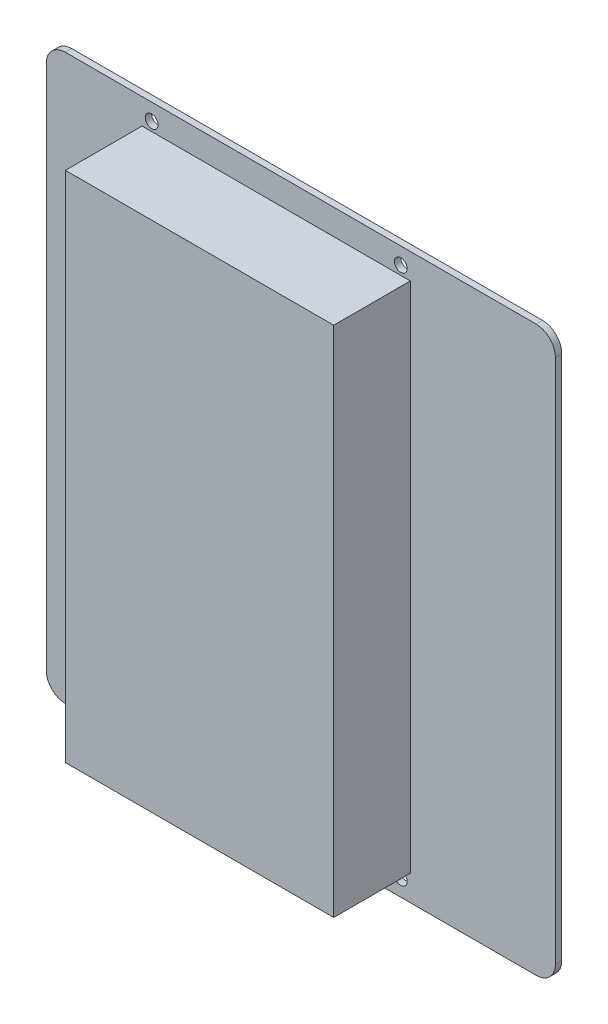
from build123d import *

# Parameters (mm, degrees)
BOSS_EXTRUDE1_DEPTH     = 1.27
SKETCH2_W               = 53.34
SKETCH2_H               = 101.981
BOSS_EXTRUDE2_DEPTH     = 15.24
CUT_EXTRUDE1_DEPTH      = 78.055045652
CUT_EXTRUDE1_DEPTH_BACK = 78.055045652
SKETCH4_R               = 1.27


with BuildPart() as part:
    # Sketch1 → Boss-Extrude1 (new body)
    with BuildSketch(Plane.XY):
        with BuildLine():
            Line((-46.7995, 56.0705), (46.7995, 56.0705))
            ThreePointArc((46.7995, 56.0705), (49.493576836, 54.954576836), (50.6095, 52.2605))
            Line((50.6095, 52.2605), (50.6095, -52.2605))
            ThreePointArc((50.6095, -52.2605), (49.493576836, -54.954576836), (46.7995, -56.0705))
            Line((46.7995, -56.0705), (-46.7995, -56.0705))
            ThreePointArc((-46.7995, -56.0705), (-49.493576836, -54.954576836), (-50.6095, -52.2605))
            Line((-50.6095, -52.2605), (-50.6095, 52.2605))
            ThreePointArc((-50.6095, 52.2605), (-49.493576836, 54.954576836), (-46.7995, 56.0705))
        make_face()
    extrude(amount=BOSS_EXTRUDE1_DEPTH)

    # Sketch2 → Boss-Extrude2 (add)
    with BuildSketch(Plane.XY.offset(1.27)):
        with Locations((-4.8895, 0)):
            Rectangle(SKETCH2_W, SKETCH2_H)
    extrude(amount=BOSS_EXTRUDE2_DEPTH)

    # Sketch4 → Cut-Extrude1 (cut, two sides: drawn at the far end of the back side and taken through both)
    with BuildSketch(Plane.XY.offset(1.27).offset(-CUT_EXTRUDE1_DEPTH_BACK)):
        with Locations((-29.6545, 52.7685)):
            Circle(SKETCH4_R)
        with Locations((19.8755, 52.7685)):
            Circle(SKETCH4_R)
        with Locations((-29.6545, -52.7685)):
            Circle(SKETCH4_R)
        with Locations((19.8755, -52.7685)):
            Circle(SKETCH4_R)
    extrude(amount=CUT_EXTRUDE1_DEPTH + CUT_EXTRUDE1_DEPTH_BACK, mode=Mode.SUBTRACT)


solid = part.part
